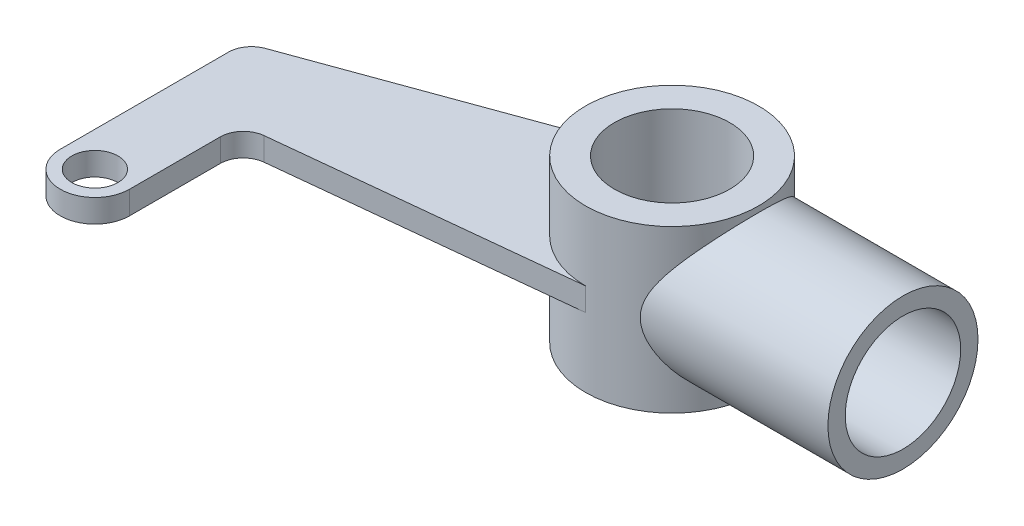
from build123d import *

# Parameters (mm, degrees)
SKETCH_1_R          = 37.5
SKETCH_1_R_2        = 25
EXTRUDE_1_DEPTH     = 70
SKETCH_2_R          = 32.5
SKETCH_2_R_2        = 25
EXTRUDE_2_DEPTH     = 100
CUT_EXTRUDE_START   = -100
SKETCH_3_R          = 25
CUT_EXTRUDE_1_DEPTH = 100
SKETCH_4_R          = 25
CUT_EXTRUDE_2_DEPTH = 100
EXTRUDE_START       = 35
SKETCH_5_R          = 15
SKETCH_5_R_2        = 10
EXTRUDE_3_DEPTH     = 5
FILLET_2_R          = 10


with BuildPart() as part:
    # 草圖1 → 填料-伸長1 (new body)
    with BuildSketch(Plane(origin=(0, 0, 0), x_dir=(1, 0, 0), z_dir=(0, 1, 0))):
        with Locations(Location((0, 0, 0), (0, 0, 270))):
            Circle(SKETCH_1_R)
        with Locations(Location((0, 0, 0), (0, 0, 270))):
            Circle(SKETCH_1_R_2, mode=Mode.SUBTRACT)
    extrude(amount=EXTRUDE_1_DEPTH)

    # 草圖2 → 填料-伸長2 (add)
    with BuildSketch(Plane(origin=(0, 0, 0), x_dir=(0, 0, -1), z_dir=(1, 0, 0))):
        with Locations(Location((0, 35, 0), (0, 0, 180))):
            Circle(SKETCH_2_R)
        with Locations(Location((0, 35, 0), (0, 0, 180))):
            Circle(SKETCH_2_R_2, mode=Mode.SUBTRACT)
    extrude(amount=EXTRUDE_2_DEPTH)

    # 草圖3 → 除料-伸長1 (cut)
    with BuildSketch(Plane(origin=(0, 70, 0), x_dir=(1, 0, 0), z_dir=(0, 1, 0)).offset(CUT_EXTRUDE_START)):
        with Locations(Location((0, 0, 0), (0, 0, 270))):
            Circle(SKETCH_3_R)
    extrude(amount=CUT_EXTRUDE_1_DEPTH, mode=Mode.SUBTRACT)

    # 草圖4 → 除料-伸長2 (cut)
    with BuildSketch(Plane(origin=(100, 0, 0), x_dir=(0, 0, -1), z_dir=(1, 0, 0)).offset(CUT_EXTRUDE_START)):
        with Locations((0, 35)):
            Circle(SKETCH_4_R)
    extrude(amount=CUT_EXTRUDE_2_DEPTH, mode=Mode.SUBTRACT)

    # 草圖5 → 填料-伸長3 (add, symmetric)
    # profile 1 of 2: a face of its own
    with BuildSketch(Plane(origin=(0, 0, 0), x_dir=(1, 0, 0), z_dir=(0, 1, 0)).offset(EXTRUDE_START)):
        with BuildLine():
            ThreePointArc((0, -37.5), (-36.930290738, -6.511806663), (-12.825755375, 35.238473279))
            Line((-12.825755375, 35.238473279), (-165, -20.148422186))
            Line((-165, -20.148422186), (-165, -100))
            ThreePointArc((-165, -100), (-150, -85), (-135, -100))
            Line((-135, -100), (-135, -51.689071761))
            Line((-135, -51.689071761), (0, -37.5))
        make_face()
    # profile 2 of 2: a face of its own
    with BuildSketch(Plane(origin=(0, 0, 0), x_dir=(1, 0, 0), z_dir=(0, 1, 0)).offset(EXTRUDE_START)):
        with Locations((-150, -100)):
            Circle(SKETCH_5_R)
        with Locations(Location((-150, -100, 0), (0, 0, 270))):
            Circle(SKETCH_5_R_2, mode=Mode.SUBTRACT)
    extrude(amount=EXTRUDE_3_DEPTH, both=True)

    # 圓角2
    fillet_2_edges = [part.edges().sort_by_distance(p)[0] for p in [
        (-165, 35, 20.148422186),
        (-135, 35, 51.689071761),
    ]]
    fillet(fillet_2_edges, radius=FILLET_2_R)


solid = part.part
